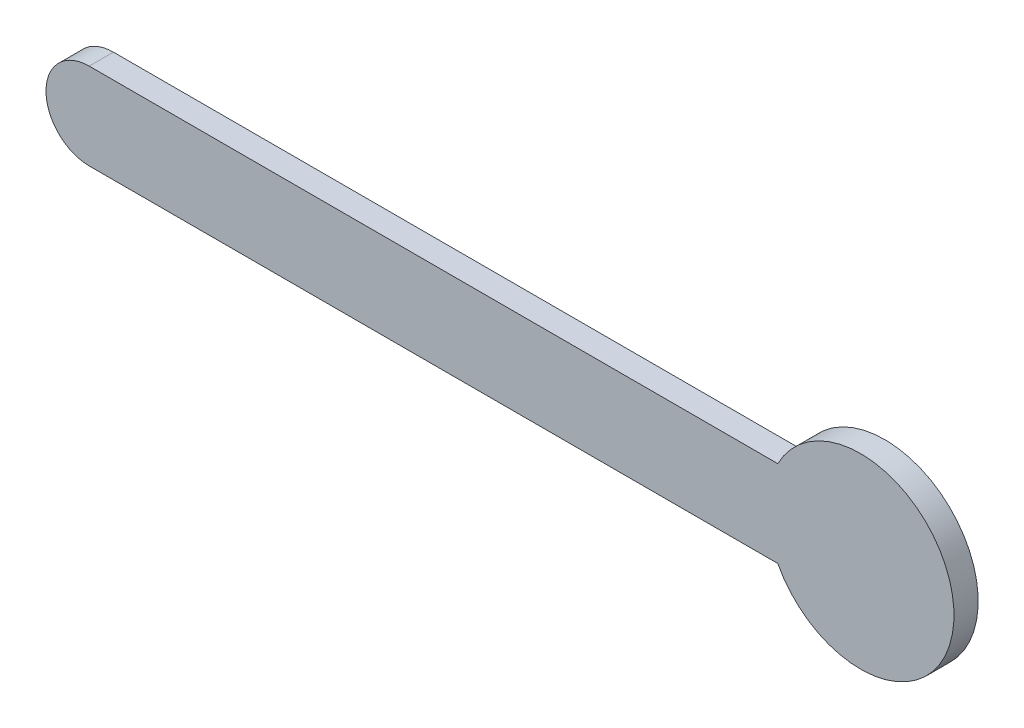
from build123d import *

# Parameters (mm, degrees)
EXTRUDE_1_DEPTH = 7


with BuildPart() as part:
    # 草图1 → 凸台-拉伸1 (new body)
    with BuildSketch(Plane.XY):
        with BuildLine():
            Line((0, 12.5), (199.067804112, 12.5))
            ThreePointArc((199.067804112, 12.5), (250, 0), (199.067804112, -12.5))
            Line((199.067804112, -12.5), (0, -12.5))
            ThreePointArc((0, -12.5), (-12.5, 0), (0, 12.5))
        make_face()
    extrude(amount=EXTRUDE_1_DEPTH)


solid = part.part
